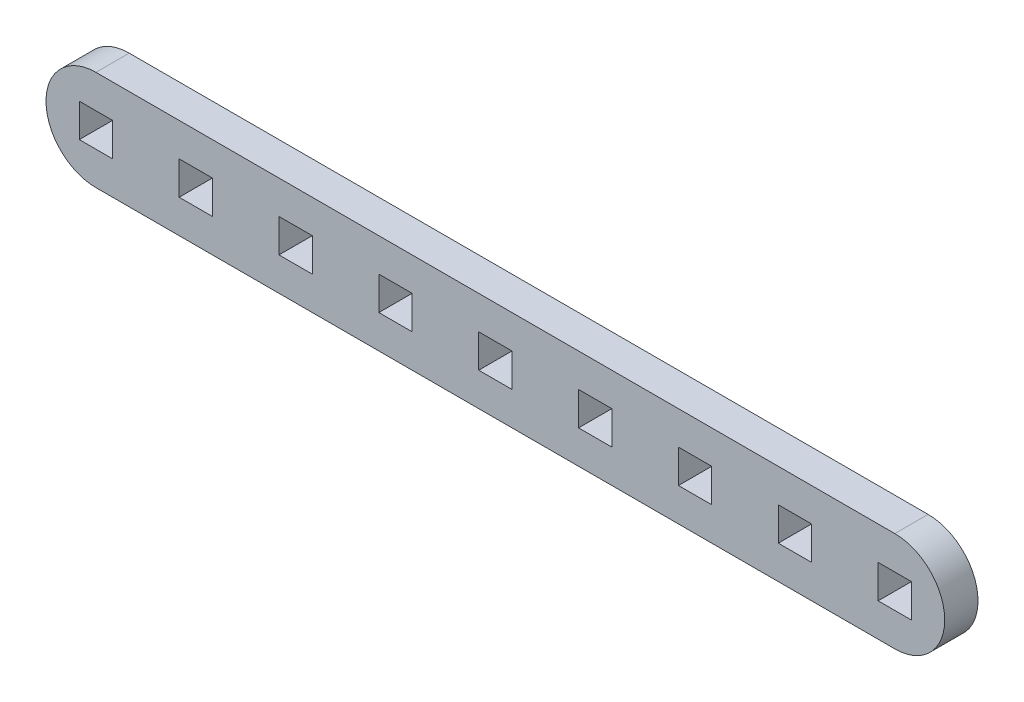
from build123d import *

# Parameters (mm, degrees)
MODEL_W                 = 3
MODEL_H                 = 3
SALIENTE_EXTRUIR1_DEPTH = 3


with BuildPart() as part:
    # Model → Saliente-Extruir1 (new body)
    with BuildSketch(Plane.XY):
        with BuildLine():
            Line((11.697885884, 299.336573121), (83.697885884, 299.336573121))
            ThreePointArc((83.697885884, 299.336573121), (88.197885884, 294.836573121), (83.697885884, 290.336573121))
            Line((83.697885884, 290.336573121), (11.697885884, 290.336573121))
            ThreePointArc((11.697885884, 290.336573121), (7.197885884, 294.836573121), (11.697885884, 299.336573121))
        make_face()
        with Locations((11.697885884, 294.836573121)):
            Rectangle(MODEL_W, MODEL_H, mode=Mode.SUBTRACT)
        with Locations((20.697885884, 294.836573121)):
            Rectangle(MODEL_W, MODEL_H, mode=Mode.SUBTRACT)
        with Locations((29.697885884, 294.836573121)):
            Rectangle(MODEL_W, MODEL_H, mode=Mode.SUBTRACT)
        with Locations((38.697885884, 294.836573121)):
            Rectangle(MODEL_W, MODEL_H, mode=Mode.SUBTRACT)
        with Locations((47.697885884, 294.836573121)):
            Rectangle(MODEL_W, MODEL_H, mode=Mode.SUBTRACT)
        with Locations((56.697885884, 294.836573121)):
            Rectangle(MODEL_W, MODEL_H, mode=Mode.SUBTRACT)
        with Locations((65.697885884, 294.836573121)):
            Rectangle(MODEL_W, MODEL_H, mode=Mode.SUBTRACT)
        with Locations((74.697885884, 294.836573121)):
            Rectangle(MODEL_W, MODEL_H, mode=Mode.SUBTRACT)
        with Locations((83.697885884, 294.836573121)):
            Rectangle(MODEL_W, MODEL_H, mode=Mode.SUBTRACT)
    extrude(amount=SALIENTE_EXTRUIR1_DEPTH)


solid = part.part
